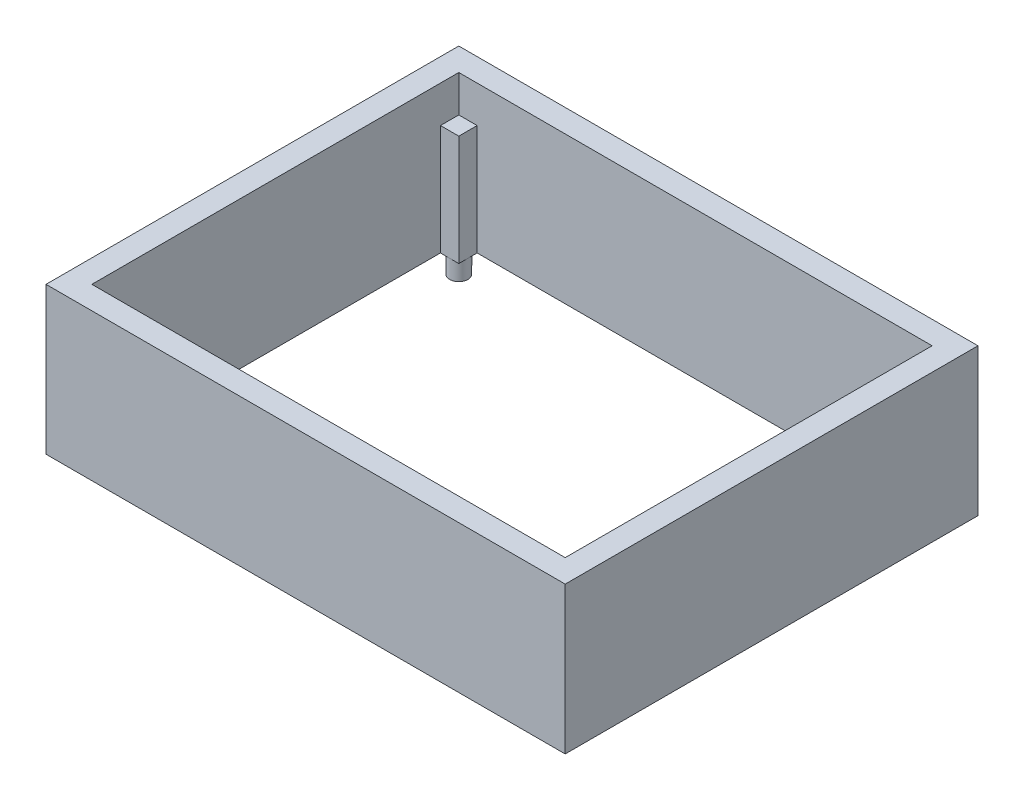
from build123d import *

# Parameters (mm, degrees)
SKETCH1_W           = 283
SKETCH1_H           = 225
BOSS_EXTRUDE1_DEPTH = 80.2
SKETCH2_W           = 258
SKETCH2_H           = 200
CUT_EXTRUDE1_DEPTH  = 80.2
SKETCH3_W           = 10
SKETCH3_H           = 10
BOSS_EXTRUDE2_DEPTH = 60.16
SKETCH4_R           = 5
BOSS_EXTRUDE3_DEPTH = 10


with BuildPart() as part:
    # Sketch1 → Boss-Extrude1 (new body)
    with BuildSketch(Plane(origin=(0, 0, 0), x_dir=(1, 0, 0), z_dir=(0, 1, 0))):
        with Locations((141.5, 112.5)):
            Rectangle(SKETCH1_W, SKETCH1_H)
    extrude(amount=BOSS_EXTRUDE1_DEPTH)

    # Sketch2 → Cut-Extrude1 (cut)
    with BuildSketch(Plane(origin=(0, 80.2, 0), x_dir=(1, 0, 0), z_dir=(0, 1, 0))):
        with Locations((141.5, 112.5)):
            Rectangle(SKETCH2_W, SKETCH2_H)
    extrude(amount=-CUT_EXTRUDE1_DEPTH, mode=Mode.SUBTRACT)

    # Sketch3 → Boss-Extrude2 (add)
    with BuildSketch(Plane.XZ):
        with Locations((17.5, -17.5)):
            Rectangle(SKETCH3_W, SKETCH3_H)
        with Locations((17.5, -207.5)):
            Rectangle(SKETCH3_W, SKETCH3_H)
        with Locations((265.5, -207.5)):
            Rectangle(SKETCH3_W, SKETCH3_H)
        with Locations((265.5, -17.5)):
            Rectangle(SKETCH3_W, SKETCH3_H)
    extrude(amount=-BOSS_EXTRUDE2_DEPTH)

    # Sketch4 → Boss-Extrude3 (add)
    with BuildSketch(Plane.XZ):
        with Locations(Location((17.5, -17.5, 0), (0, 0, 270))):
            Circle(SKETCH4_R)
        with Locations(Location((265.5, -17.5, 0), (0, 0, 270))):
            Circle(SKETCH4_R)
        with Locations(Location((265.5, -207.5, 0), (0, 0, 90))):
            Circle(SKETCH4_R)
        with Locations(Location((17.5, -207.5, 0), (0, 0, 90))):
            Circle(SKETCH4_R)
    extrude(amount=BOSS_EXTRUDE3_DEPTH)


solid = part.part
